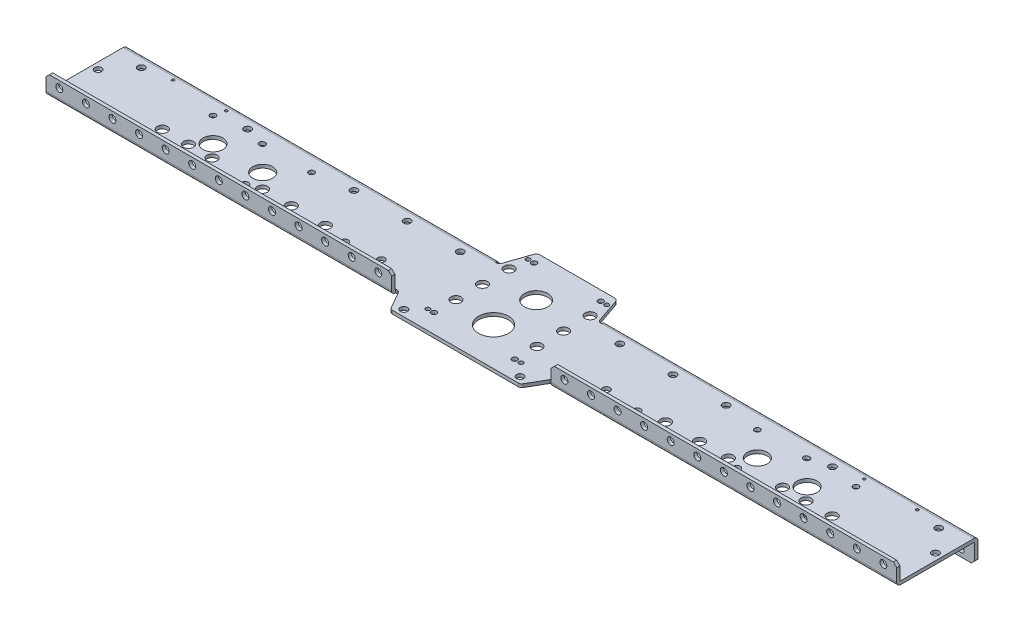
from build123d import *

# Parameters (mm, degrees)
SKETCH1_R           = 3.3528
SKETCH1_R_2         = 9.525
SKETCH1_R_3         = 4.826
SKETCH1_R_4         = 1.27
SKETCH1_R_5         = 2.667
SKETCH1_R_6         = 3.4036
SKETCH1_R_7         = 2.032
SKETCH1_R_8         = 2.54
SKETCH1_R_9         = 4.7625
SKETCH1_R_10        = 11.1125
SKETCH1_R_11        = 14.2875
BOSS_EXTRUDE1_DEPTH = 3.175
BOSS_EXTRUDE2_DEPTH = 355.6
CUT_EXTRUDE1_REACH  = 820.306
SKETCH4_R           = 2.667
BOSS_EXTRUDE3_DEPTH = 330.2
CUT_EXTRUDE2_REACH  = 820.914
SKETCH7_R           = 3.3528
BOSS_EXTRUDE4_START = -355.6
BOSS_EXTRUDE4_DEPTH = 355.6
BOSS_EXTRUDE5_START = -330.2
BOSS_EXTRUDE5_DEPTH = 330.2
CHAMFER1_SIZE       = 3.175
CUT_EXTRUDE3_REACH  = 821.3
SKETCH9_R           = 3.3528
CUT_EXTRUDE4_REACH  = 820.306
SKETCH10_R          = 2.667


with BuildPart() as part:
    # Sketch1 → Boss-Extrude1 (new body)
    with BuildSketch(Plane(origin=(0, 0, 0), x_dir=(1, 0, 0), z_dir=(0, 1, 0))):
        with BuildLine():
            Line((442.314699422, 97.282), (370.485300578, 97.282))
            ThreePointArc((370.485300578, 97.282), (368.641568694, 96.691816771), (367.483279101, 95.14067889))
            Line((367.483279101, 95.14067889), (359.512315987, 71.99132111))
            ThreePointArc((359.512315987, 71.99132111), (358.354026394, 70.440183229), (356.510294509, 69.85))
            Line((356.510294509, 69.85), (355.6, 69.85))
            Line((355.6, 69.85), (0, 69.85))
            Line((0, 69.85), (0, 0))
            Line((0, 0), (330.2, 0))
            Line((330.2, 0), (331.541912895, 0))
            ThreePointArc((331.541912895, 0), (333.129412895, -0.425369343), (334.291543552, -1.5875))
            Line((334.291543552, -1.5875), (343.456979076, -17.4625))
            ThreePointArc((343.456979076, -17.4625), (344.619109733, -18.624630657), (346.206609733, -19.05))
            Line((346.206609733, -19.05), (466.593390267, -19.05))
            ThreePointArc((466.593390267, -19.05), (468.180890267, -18.624630657), (469.343020924, -17.4625))
            Line((469.343020924, -17.4625), (478.508456448, -1.5875))
            ThreePointArc((478.508456448, -1.5875), (479.670587105, -0.425369343), (481.258087105, 0))
            Line((481.258087105, 0), (482.6, 0))
            Line((482.6, 0), (812.8, 0))
            Line((812.8, 0), (812.8, 69.85))
            Line((812.8, 69.85), (457.2, 69.85))
            Line((457.2, 69.85), (456.289705491, 69.85))
            ThreePointArc((456.289705491, 69.85), (454.445973606, 70.440183229), (453.287684013, 71.99132111))
            Line((453.287684013, 71.99132111), (445.316720899, 95.14067889))
            ThreePointArc((445.316720899, 95.14067889), (444.158431306, 96.691816771), (442.314699422, 97.282))
        make_face()
        with Locations(Location((806.45, 39.497, 0), (0, 0, 270))):
            Circle(SKETCH1_R, mode=Mode.SUBTRACT)
        with Locations(Location((641.35, 14.732, 0), (0, 0, 270))):
            Circle(SKETCH1_R, mode=Mode.SUBTRACT)
        with Locations(Location((642.712889143, 33.02, 0), (0, 0, 270))):
            Circle(SKETCH1_R_2, mode=Mode.SUBTRACT)
        with Locations(Location((678.944202666, 20.828, 0), (0, 0, 270))):
            Circle(SKETCH1_R_3, mode=Mode.SUBTRACT)
        with Locations(Location((711.2, 3.175, 0), (0, 0, 270))):
            Circle(SKETCH1_R_4, mode=Mode.SUBTRACT)
        with Locations(Location((713.545953249, 9.671334085, 0), (0, 0, 270))):
            Circle(SKETCH1_R_5, mode=Mode.SUBTRACT)
        with Locations(Location((701.450372003, 20.828, 0), (0, 0, 270))):
            Circle(SKETCH1_R_3, mode=Mode.SUBTRACT)
        with Locations(Location((690.197287335, 33.02, 0), (0, 0, 270))):
            Circle(SKETCH1_R_2, mode=Mode.SUBTRACT)
        with Locations(Location((685.8, 61.722, 0), (0, 0, 270))):
            Circle(SKETCH1_R, mode=Mode.SUBTRACT)
        with Locations(Location((711.2, 66.675, 0), (0, 0, 270))):
            Circle(SKETCH1_R_4, mode=Mode.SUBTRACT)
        with Locations(Location((713.545953249, 56.368665915, 0), (0, 0, 270))):
            Circle(SKETCH1_R_5, mode=Mode.SUBTRACT)
        with Locations(Location((726.460886343, 20.828, 0), (0, 0, 270))):
            Circle(SKETCH1_R_3, mode=Mode.SUBTRACT)
        with Locations(Location((762, 3.175, 0), (0, 0, 270))):
            Circle(SKETCH1_R_4, mode=Mode.SUBTRACT)
        with Locations(Location((762, 66.675, 0), (0, 0, 270))):
            Circle(SKETCH1_R_4, mode=Mode.SUBTRACT)
        with Locations(Location((787.4, 61.722, 0), (0, 0, 270))):
            Circle(SKETCH1_R, mode=Mode.SUBTRACT)
        with Locations(Location((350.8375, -12.8905, 0), (0, 0, 270))):
            Circle(SKETCH1_R_6, mode=Mode.SUBTRACT)
        with Locations(Location((361.9119, -1.03886, 0), (0, 0, 270))):
            Circle(SKETCH1_R_7, mode=Mode.SUBTRACT)
        with Locations(Location((367.7539, -1.03886, 0), (0, 0, 270))):
            Circle(SKETCH1_R_8, mode=Mode.SUBTRACT)
        with Locations(Location((367.67570279, 20.066, 0), (0, 0, 270))):
            Circle(SKETCH1_R_9, mode=Mode.SUBTRACT)
        with Locations(Location((367.67570279, 45.466, 0), (0, 0, 270))):
            Circle(SKETCH1_R_9, mode=Mode.SUBTRACT)
        with Locations(Location((367.67570279, 70.866, 0), (0, 0, 270))):
            Circle(SKETCH1_R_9, mode=Mode.SUBTRACT)
        with Locations(Location((368.808, 87.85352, 0), (0, 0, 270))):
            Circle(SKETCH1_R_7, mode=Mode.SUBTRACT)
        with Locations(Location((374.65, 87.85352, 0), (0, 0, 270))):
            Circle(SKETCH1_R_8, mode=Mode.SUBTRACT)
        with Locations(Location((406.4, 57.9628, 0), (0, 0, 270))):
            Circle(SKETCH1_R_10, mode=Mode.SUBTRACT)
        with Locations(Location((406.4, 17.272, 0), (0, 0, 270))):
            Circle(SKETCH1_R_11, mode=Mode.SUBTRACT)
        with Locations(Location((461.9625, -12.8905, 0), (0, 0, 270))):
            Circle(SKETCH1_R_6, mode=Mode.SUBTRACT)
        with Locations(Location((445.0461, -1.03886, 0), (0, 0, 270))):
            Circle(SKETCH1_R_8, mode=Mode.SUBTRACT)
        with Locations(Location((450.8881, -1.03886, 0), (0, 0, 270))):
            Circle(SKETCH1_R_7, mode=Mode.SUBTRACT)
        with Locations(Location((445.12429721, 20.066, 0), (0, 0, 270))):
            Circle(SKETCH1_R_9, mode=Mode.SUBTRACT)
        with Locations(Location((445.12429721, 45.466, 0), (0, 0, 270))):
            Circle(SKETCH1_R_9, mode=Mode.SUBTRACT)
        with Locations(Location((438.15, 87.85352, 0), (0, 0, 270))):
            Circle(SKETCH1_R_8, mode=Mode.SUBTRACT)
        with Locations(Location((443.992, 87.85352, 0), (0, 0, 270))):
            Circle(SKETCH1_R_7, mode=Mode.SUBTRACT)
        with Locations(Location((445.12429721, 70.866, 0), (0, 0, 270))):
            Circle(SKETCH1_R_9, mode=Mode.SUBTRACT)
        with Locations(Location((482.6, 61.722, 0), (0, 0, 270))):
            Circle(SKETCH1_R, mode=Mode.SUBTRACT)
        with Locations(Location((513.925467617, 17.547282407, 0), (0, 0, 270))):
            Circle(SKETCH1_R, mode=Mode.SUBTRACT)
        with Locations(Location((533.4, 61.722, 0), (0, 0, 270))):
            Circle(SKETCH1_R, mode=Mode.SUBTRACT)
        with Locations(Location((546.1, 14.732, 0), (0, 0, 270))):
            Circle(SKETCH1_R, mode=Mode.SUBTRACT)
        with Locations(Location((568.924874752, 19.05, 0), (0, 0, 270))):
            Circle(SKETCH1_R_3, mode=Mode.SUBTRACT)
        with Locations(Location((584.2, 61.722, 0), (0, 0, 270))):
            Circle(SKETCH1_R, mode=Mode.SUBTRACT)
        with Locations(Location((619.364223229, 56.368665915, 0), (0, 0, 270))):
            Circle(SKETCH1_R_5, mode=Mode.SUBTRACT)
        with Locations(Location((601.438495912, 19.05, 0), (0, 0, 270))):
            Circle(SKETCH1_R_3, mode=Mode.SUBTRACT)
        with Locations(Location((619.364223229, 9.671334085, 0), (0, 0, 270))):
            Circle(SKETCH1_R_5, mode=Mode.SUBTRACT)
        with Locations(Location((628.947697627, 19.05, 0), (0, 0, 270))):
            Circle(SKETCH1_R_3, mode=Mode.SUBTRACT)
        with Locations(Location((298.874532383, 17.547282407, 0), (0, 0, 270))):
            Circle(SKETCH1_R, mode=Mode.SUBTRACT)
        with Locations(Location((266.7, 14.732, 0), (0, 0, 270))):
            Circle(SKETCH1_R, mode=Mode.SUBTRACT)
        with Locations(Location((243.875125248, 19.05, 0), (0, 0, 270))):
            Circle(SKETCH1_R_3, mode=Mode.SUBTRACT)
        with Locations(Location((211.361504088, 19.05, 0), (0, 0, 270))):
            Circle(SKETCH1_R_3, mode=Mode.SUBTRACT)
        with Locations(Location((193.435776771, 9.671334085, 0), (0, 0, 270))):
            Circle(SKETCH1_R_5, mode=Mode.SUBTRACT)
        with Locations(Location((183.852302373, 19.05, 0), (0, 0, 270))):
            Circle(SKETCH1_R_3, mode=Mode.SUBTRACT)
        with Locations(Location((170.087110857, 33.02, 0), (0, 0, 270))):
            Circle(SKETCH1_R_2, mode=Mode.SUBTRACT)
        with Locations(Location((171.45, 14.732, 0), (0, 0, 270))):
            Circle(SKETCH1_R, mode=Mode.SUBTRACT)
        with Locations(Location((133.855797334, 20.828, 0), (0, 0, 270))):
            Circle(SKETCH1_R_3, mode=Mode.SUBTRACT)
        with Locations(Location((122.602712665, 33.02, 0), (0, 0, 270))):
            Circle(SKETCH1_R_2, mode=Mode.SUBTRACT)
        with Locations(Location((99.254046751, 56.368665915, 0), (0, 0, 270))):
            Circle(SKETCH1_R_5, mode=Mode.SUBTRACT)
        with Locations(Location((101.6, 66.675, 0), (0, 0, 270))):
            Circle(SKETCH1_R_4, mode=Mode.SUBTRACT)
        with Locations(Location((127, 61.722, 0), (0, 0, 270))):
            Circle(SKETCH1_R, mode=Mode.SUBTRACT)
        with Locations(Location((193.435776771, 56.368665915, 0), (0, 0, 270))):
            Circle(SKETCH1_R_5, mode=Mode.SUBTRACT)
        with Locations(Location((228.6, 61.722, 0), (0, 0, 270))):
            Circle(SKETCH1_R, mode=Mode.SUBTRACT)
        with Locations(Location((279.4, 61.722, 0), (0, 0, 270))):
            Circle(SKETCH1_R, mode=Mode.SUBTRACT)
        with Locations(Location((330.2, 61.722, 0), (0, 0, 270))):
            Circle(SKETCH1_R, mode=Mode.SUBTRACT)
        with Locations(Location((50.8, 66.675, 0), (0, 0, 270))):
            Circle(SKETCH1_R_4, mode=Mode.SUBTRACT)
        with Locations(Location((6.35, 39.497, 0), (0, 0, 270))):
            Circle(SKETCH1_R, mode=Mode.SUBTRACT)
        with Locations(Location((25.4, 61.722, 0), (0, 0, 270))):
            Circle(SKETCH1_R, mode=Mode.SUBTRACT)
        with Locations(Location((50.8, 3.175, 0), (0, 0, 270))):
            Circle(SKETCH1_R_4, mode=Mode.SUBTRACT)
        with Locations(Location((101.6, 3.175, 0), (0, 0, 270))):
            Circle(SKETCH1_R_4, mode=Mode.SUBTRACT)
        with Locations(Location((99.254046751, 9.671334085, 0), (0, 0, 270))):
            Circle(SKETCH1_R_5, mode=Mode.SUBTRACT)
        with Locations(Location((86.339113657, 20.828, 0), (0, 0, 270))):
            Circle(SKETCH1_R_3, mode=Mode.SUBTRACT)
        with Locations(Location((111.349627997, 20.828, 0), (0, 0, 270))):
            Circle(SKETCH1_R_3, mode=Mode.SUBTRACT)
        with BuildLine():
            ThreePointArc((666.455088239, 53.730859888), (669.51562142, 56.368665915), (666.455088239, 59.006471942))
            ThreePointArc((666.455088239, 59.006471942), (663.394555058, 56.368665915), (666.455088239, 53.730859888))
        make_face(mode=Mode.SUBTRACT)
        with BuildLine():
            ThreePointArc((666.455088239, 7.033528058), (669.51562142, 9.671334085), (666.455088239, 12.309140112))
            ThreePointArc((666.455088239, 12.309140112), (663.394555058, 9.671334085), (666.455088239, 7.033528058))
        make_face(mode=Mode.SUBTRACT)
        with BuildLine():
            ThreePointArc((146.344911761, 7.033528058), (149.405444942, 9.671334085), (146.344911761, 12.309140112))
            ThreePointArc((146.344911761, 12.309140112), (143.28437858, 9.671334085), (146.344911761, 7.033528058))
        make_face(mode=Mode.SUBTRACT)
        with BuildLine():
            ThreePointArc((146.344911761, 53.730859888), (149.405444942, 56.368665915), (146.344911761, 59.006471942))
            ThreePointArc((146.344911761, 59.006471942), (143.28437858, 56.368665915), (146.344911761, 53.730859888))
        make_face(mode=Mode.SUBTRACT)
    extrude(amount=BOSS_EXTRUDE1_DEPTH)

    # Sketch3 → Boss-Extrude2 (add)
    with BuildSketch(Plane.ZY):
        with BuildLine():
            Line((-70.612, -15.875), (-70.612, -19.05))
            Line((-70.612, -19.05), (-73.787, -19.05))
            Line((-73.787, -19.05), (-73.787, -15.875))
            Line((-73.787, -15.875), (-73.787, -0.762))
            ThreePointArc((-73.787, -0.762), (-72.633879398, 2.021879398), (-69.85, 3.175))
            Line((-69.85, 3.175), (-69.85, 0))
            ThreePointArc((-69.85, 0), (-70.388815367, -0.223184633), (-70.612, -0.762))
            Line((-70.612, -0.762), (-70.612, -15.875))
        make_face()
    extrude(amount=-BOSS_EXTRUDE2_DEPTH)

    # Sketch4 → Cut-Extrude1 (cut, up to next)
    with BuildSketch(Plane(origin=(0, 0, -73.787), x_dir=(-1, 0, 0), z_dir=(0, 0, -1)), mode=Mode.PRIVATE) as cut_extrude1_sk1:
        with Locations(Location((-342.9, -12.7, 0), (0, 0, 90))):
            Circle(SKETCH4_R)
    cut_extrude1_tool1 = extrude(cut_extrude1_sk1.sketch, amount=-CUT_EXTRUDE1_REACH, mode=Mode.PRIVATE) & part.part
    # Sketch4 → Cut-Extrude1 (cut, up to next)
    with BuildSketch(Plane(origin=(0, 0, -73.787), x_dir=(-1, 0, 0), z_dir=(0, 0, -1)), mode=Mode.PRIVATE) as cut_extrude1_sk2:
        with Locations(Location((-317.5, -12.7, 0), (0, 0, 90))):
            Circle(SKETCH4_R)
    cut_extrude1_tool2 = extrude(cut_extrude1_sk2.sketch, amount=-CUT_EXTRUDE1_REACH, mode=Mode.PRIVATE) & part.part
    # Sketch4 → Cut-Extrude1 (cut, up to next)
    with BuildSketch(Plane(origin=(0, 0, -73.787), x_dir=(-1, 0, 0), z_dir=(0, 0, -1)), mode=Mode.PRIVATE) as cut_extrude1_sk3:
        with Locations(Location((-292.1, -12.7, 0), (0, 0, 90))):
            Circle(SKETCH4_R)
    cut_extrude1_tool3 = extrude(cut_extrude1_sk3.sketch, amount=-CUT_EXTRUDE1_REACH, mode=Mode.PRIVATE) & part.part
    # Sketch4 → Cut-Extrude1 (cut, up to next)
    with BuildSketch(Plane(origin=(0, 0, -73.787), x_dir=(-1, 0, 0), z_dir=(0, 0, -1)), mode=Mode.PRIVATE) as cut_extrude1_sk4:
        with Locations(Location((-266.7, -12.7, 0), (0, 0, 90))):
            Circle(SKETCH4_R)
    cut_extrude1_tool4 = extrude(cut_extrude1_sk4.sketch, amount=-CUT_EXTRUDE1_REACH, mode=Mode.PRIVATE) & part.part
    # Sketch4 → Cut-Extrude1 (cut, up to next)
    with BuildSketch(Plane(origin=(0, 0, -73.787), x_dir=(-1, 0, 0), z_dir=(0, 0, -1)), mode=Mode.PRIVATE) as cut_extrude1_sk5:
        with Locations(Location((-241.3, -12.7, 0), (0, 0, 90))):
            Circle(SKETCH4_R)
    cut_extrude1_tool5 = extrude(cut_extrude1_sk5.sketch, amount=-CUT_EXTRUDE1_REACH, mode=Mode.PRIVATE) & part.part
    # Sketch4 → Cut-Extrude1 (cut, up to next)
    with BuildSketch(Plane(origin=(0, 0, -73.787), x_dir=(-1, 0, 0), z_dir=(0, 0, -1)), mode=Mode.PRIVATE) as cut_extrude1_sk6:
        with Locations(Location((-215.9, -12.7, 0), (0, 0, 90))):
            Circle(SKETCH4_R)
    cut_extrude1_tool6 = extrude(cut_extrude1_sk6.sketch, amount=-CUT_EXTRUDE1_REACH, mode=Mode.PRIVATE) & part.part
    # Sketch4 → Cut-Extrude1 (cut, up to next)
    with BuildSketch(Plane(origin=(0, 0, -73.787), x_dir=(-1, 0, 0), z_dir=(0, 0, -1)), mode=Mode.PRIVATE) as cut_extrude1_sk7:
        with Locations(Location((-190.5, -12.7, 0), (0, 0, 90))):
            Circle(SKETCH4_R)
    cut_extrude1_tool7 = extrude(cut_extrude1_sk7.sketch, amount=-CUT_EXTRUDE1_REACH, mode=Mode.PRIVATE) & part.part
    # Sketch4 → Cut-Extrude1 (cut, up to next)
    with BuildSketch(Plane(origin=(0, 0, -73.787), x_dir=(-1, 0, 0), z_dir=(0, 0, -1)), mode=Mode.PRIVATE) as cut_extrude1_sk8:
        with Locations(Location((-165.1, -12.7, 0), (0, 0, 90))):
            Circle(SKETCH4_R)
    cut_extrude1_tool8 = extrude(cut_extrude1_sk8.sketch, amount=-CUT_EXTRUDE1_REACH, mode=Mode.PRIVATE) & part.part
    # Sketch4 → Cut-Extrude1 (cut, up to next)
    with BuildSketch(Plane(origin=(0, 0, -73.787), x_dir=(-1, 0, 0), z_dir=(0, 0, -1)), mode=Mode.PRIVATE) as cut_extrude1_sk9:
        with Locations(Location((-139.7, -12.7, 0), (0, 0, 90))):
            Circle(SKETCH4_R)
    cut_extrude1_tool9 = extrude(cut_extrude1_sk9.sketch, amount=-CUT_EXTRUDE1_REACH, mode=Mode.PRIVATE) & part.part
    # Sketch4 → Cut-Extrude1 (cut, up to next)
    with BuildSketch(Plane(origin=(0, 0, -73.787), x_dir=(-1, 0, 0), z_dir=(0, 0, -1)), mode=Mode.PRIVATE) as cut_extrude1_sk10:
        with Locations(Location((-114.3, -12.7, 0), (0, 0, 90))):
            Circle(SKETCH4_R)
    cut_extrude1_tool10 = extrude(cut_extrude1_sk10.sketch, amount=-CUT_EXTRUDE1_REACH, mode=Mode.PRIVATE) & part.part
    # Sketch4 → Cut-Extrude1 (cut, up to next)
    with BuildSketch(Plane(origin=(0, 0, -73.787), x_dir=(-1, 0, 0), z_dir=(0, 0, -1)), mode=Mode.PRIVATE) as cut_extrude1_sk11:
        with Locations(Location((-88.9, -12.7, 0), (0, 0, 90))):
            Circle(SKETCH4_R)
    cut_extrude1_tool11 = extrude(cut_extrude1_sk11.sketch, amount=-CUT_EXTRUDE1_REACH, mode=Mode.PRIVATE) & part.part
    # Sketch4 → Cut-Extrude1 (cut, up to next)
    with BuildSketch(Plane(origin=(0, 0, -73.787), x_dir=(-1, 0, 0), z_dir=(0, 0, -1)), mode=Mode.PRIVATE) as cut_extrude1_sk12:
        with Locations(Location((-63.5, -12.7, 0), (0, 0, 90))):
            Circle(SKETCH4_R)
    cut_extrude1_tool12 = extrude(cut_extrude1_sk12.sketch, amount=-CUT_EXTRUDE1_REACH, mode=Mode.PRIVATE) & part.part
    # Sketch4 → Cut-Extrude1 (cut, up to next)
    with BuildSketch(Plane(origin=(0, 0, -73.787), x_dir=(-1, 0, 0), z_dir=(0, 0, -1)), mode=Mode.PRIVATE) as cut_extrude1_sk13:
        with Locations(Location((-38.1, -12.7, 0), (0, 0, 90))):
            Circle(SKETCH4_R)
    cut_extrude1_tool13 = extrude(cut_extrude1_sk13.sketch, amount=-CUT_EXTRUDE1_REACH, mode=Mode.PRIVATE) & part.part
    # Sketch4 → Cut-Extrude1 (cut, up to next)
    with BuildSketch(Plane(origin=(0, 0, -73.787), x_dir=(-1, 0, 0), z_dir=(0, 0, -1)), mode=Mode.PRIVATE) as cut_extrude1_sk14:
        with Locations(Location((-12.7, -12.7, 0), (0, 0, 90))):
            Circle(SKETCH4_R)
    cut_extrude1_tool14 = extrude(cut_extrude1_sk14.sketch, amount=-CUT_EXTRUDE1_REACH, mode=Mode.PRIVATE) & part.part
    add(cut_extrude1_tool1.solids().sort_by_distance((342.9, -12.7, -73.787))[0], mode=Mode.SUBTRACT)
    add(cut_extrude1_tool2.solids().sort_by_distance((317.5, -12.7, -73.787))[0], mode=Mode.SUBTRACT)
    add(cut_extrude1_tool3.solids().sort_by_distance((292.1, -12.7, -73.787))[0], mode=Mode.SUBTRACT)
    add(cut_extrude1_tool4.solids().sort_by_distance((266.7, -12.7, -73.787))[0], mode=Mode.SUBTRACT)
    add(cut_extrude1_tool5.solids().sort_by_distance((241.3, -12.7, -73.787))[0], mode=Mode.SUBTRACT)
    add(cut_extrude1_tool6.solids().sort_by_distance((215.9, -12.7, -73.787))[0], mode=Mode.SUBTRACT)
    add(cut_extrude1_tool7.solids().sort_by_distance((190.5, -12.7, -73.787))[0], mode=Mode.SUBTRACT)
    add(cut_extrude1_tool8.solids().sort_by_distance((165.1, -12.7, -73.787))[0], mode=Mode.SUBTRACT)
    add(cut_extrude1_tool9.solids().sort_by_distance((139.7, -12.7, -73.787))[0], mode=Mode.SUBTRACT)
    add(cut_extrude1_tool10.solids().sort_by_distance((114.3, -12.7, -73.787))[0], mode=Mode.SUBTRACT)
    add(cut_extrude1_tool11.solids().sort_by_distance((88.9, -12.7, -73.787))[0], mode=Mode.SUBTRACT)
    add(cut_extrude1_tool12.solids().sort_by_distance((63.5, -12.7, -73.787))[0], mode=Mode.SUBTRACT)
    add(cut_extrude1_tool13.solids().sort_by_distance((38.1, -12.7, -73.787))[0], mode=Mode.SUBTRACT)
    add(cut_extrude1_tool14.solids().sort_by_distance((12.7, -12.7, -73.787))[0], mode=Mode.SUBTRACT)

    # Sketch5 → Boss-Extrude3 (add)
    with BuildSketch(Plane.ZY):
        with BuildLine():
            Line((3.937, 3.937), (3.937, 15.875))
            Line((3.937, 15.875), (3.937, 19.05))
            Line((3.937, 19.05), (0.762, 19.05))
            Line((0.762, 19.05), (0.762, 15.875))
            Line((0.762, 15.875), (0.762, 3.937))
            ThreePointArc((0.762, 3.937), (0.538815367, 3.398184633), (0, 3.175))
            Line((0, 3.175), (0, 0))
            ThreePointArc((0, 0), (2.783879398, 1.153120602), (3.937, 3.937))
        make_face()
    extrude(amount=-BOSS_EXTRUDE3_DEPTH)

    # Sketch7 → Cut-Extrude2 (cut, up to next)
    with BuildSketch(Plane(origin=(0, 0, 0.762), x_dir=(-1, 0, 0), z_dir=(0, 0, -1)), mode=Mode.PRIVATE) as cut_extrude2_sk1:
        with Locations(Location((-12.7, 12.7, 0), (0, 0, 90))):
            Circle(SKETCH7_R)
    cut_extrude2_tool1 = extrude(cut_extrude2_sk1.sketch, amount=-CUT_EXTRUDE2_REACH, mode=Mode.PRIVATE) & part.part
    # Sketch7 → Cut-Extrude2 (cut, up to next)
    with BuildSketch(Plane(origin=(0, 0, 0.762), x_dir=(-1, 0, 0), z_dir=(0, 0, -1)), mode=Mode.PRIVATE) as cut_extrude2_sk2:
        with Locations(Location((-38.1, 12.7, 0), (0, 0, 90))):
            Circle(SKETCH7_R)
    cut_extrude2_tool2 = extrude(cut_extrude2_sk2.sketch, amount=-CUT_EXTRUDE2_REACH, mode=Mode.PRIVATE) & part.part
    # Sketch7 → Cut-Extrude2 (cut, up to next)
    with BuildSketch(Plane(origin=(0, 0, 0.762), x_dir=(-1, 0, 0), z_dir=(0, 0, -1)), mode=Mode.PRIVATE) as cut_extrude2_sk3:
        with Locations(Location((-63.5, 12.7, 0), (0, 0, 90))):
            Circle(SKETCH7_R)
    cut_extrude2_tool3 = extrude(cut_extrude2_sk3.sketch, amount=-CUT_EXTRUDE2_REACH, mode=Mode.PRIVATE) & part.part
    # Sketch7 → Cut-Extrude2 (cut, up to next)
    with BuildSketch(Plane(origin=(0, 0, 0.762), x_dir=(-1, 0, 0), z_dir=(0, 0, -1)), mode=Mode.PRIVATE) as cut_extrude2_sk4:
        with Locations(Location((-88.9, 12.7, 0), (0, 0, 90))):
            Circle(SKETCH7_R)
    cut_extrude2_tool4 = extrude(cut_extrude2_sk4.sketch, amount=-CUT_EXTRUDE2_REACH, mode=Mode.PRIVATE) & part.part
    # Sketch7 → Cut-Extrude2 (cut, up to next)
    with BuildSketch(Plane(origin=(0, 0, 0.762), x_dir=(-1, 0, 0), z_dir=(0, 0, -1)), mode=Mode.PRIVATE) as cut_extrude2_sk5:
        with Locations(Location((-114.3, 12.7, 0), (0, 0, 90))):
            Circle(SKETCH7_R)
    cut_extrude2_tool5 = extrude(cut_extrude2_sk5.sketch, amount=-CUT_EXTRUDE2_REACH, mode=Mode.PRIVATE) & part.part
    # Sketch7 → Cut-Extrude2 (cut, up to next)
    with BuildSketch(Plane(origin=(0, 0, 0.762), x_dir=(-1, 0, 0), z_dir=(0, 0, -1)), mode=Mode.PRIVATE) as cut_extrude2_sk6:
        with Locations(Location((-241.3, 12.7, 0), (0, 0, 90))):
            Circle(SKETCH7_R)
    cut_extrude2_tool6 = extrude(cut_extrude2_sk6.sketch, amount=-CUT_EXTRUDE2_REACH, mode=Mode.PRIVATE) & part.part
    # Sketch7 → Cut-Extrude2 (cut, up to next)
    with BuildSketch(Plane(origin=(0, 0, 0.762), x_dir=(-1, 0, 0), z_dir=(0, 0, -1)), mode=Mode.PRIVATE) as cut_extrude2_sk7:
        with Locations(Location((-215.9, 12.7, 0), (0, 0, 90))):
            Circle(SKETCH7_R)
    cut_extrude2_tool7 = extrude(cut_extrude2_sk7.sketch, amount=-CUT_EXTRUDE2_REACH, mode=Mode.PRIVATE) & part.part
    # Sketch7 → Cut-Extrude2 (cut, up to next)
    with BuildSketch(Plane(origin=(0, 0, 0.762), x_dir=(-1, 0, 0), z_dir=(0, 0, -1)), mode=Mode.PRIVATE) as cut_extrude2_sk8:
        with Locations(Location((-190.5, 12.7, 0), (0, 0, 90))):
            Circle(SKETCH7_R)
    cut_extrude2_tool8 = extrude(cut_extrude2_sk8.sketch, amount=-CUT_EXTRUDE2_REACH, mode=Mode.PRIVATE) & part.part
    # Sketch7 → Cut-Extrude2 (cut, up to next)
    with BuildSketch(Plane(origin=(0, 0, 0.762), x_dir=(-1, 0, 0), z_dir=(0, 0, -1)), mode=Mode.PRIVATE) as cut_extrude2_sk9:
        with Locations(Location((-165.1, 12.7, 0), (0, 0, 90))):
            Circle(SKETCH7_R)
    cut_extrude2_tool9 = extrude(cut_extrude2_sk9.sketch, amount=-CUT_EXTRUDE2_REACH, mode=Mode.PRIVATE) & part.part
    # Sketch7 → Cut-Extrude2 (cut, up to next)
    with BuildSketch(Plane(origin=(0, 0, 0.762), x_dir=(-1, 0, 0), z_dir=(0, 0, -1)), mode=Mode.PRIVATE) as cut_extrude2_sk10:
        with Locations(Location((-139.7, 12.7, 0), (0, 0, 90))):
            Circle(SKETCH7_R)
    cut_extrude2_tool10 = extrude(cut_extrude2_sk10.sketch, amount=-CUT_EXTRUDE2_REACH, mode=Mode.PRIVATE) & part.part
    # Sketch7 → Cut-Extrude2 (cut, up to next)
    with BuildSketch(Plane(origin=(0, 0, 0.762), x_dir=(-1, 0, 0), z_dir=(0, 0, -1)), mode=Mode.PRIVATE) as cut_extrude2_sk11:
        with Locations(Location((-317.5, 12.7, 0), (0, 0, 90))):
            Circle(SKETCH7_R)
    cut_extrude2_tool11 = extrude(cut_extrude2_sk11.sketch, amount=-CUT_EXTRUDE2_REACH, mode=Mode.PRIVATE) & part.part
    # Sketch7 → Cut-Extrude2 (cut, up to next)
    with BuildSketch(Plane(origin=(0, 0, 0.762), x_dir=(-1, 0, 0), z_dir=(0, 0, -1)), mode=Mode.PRIVATE) as cut_extrude2_sk12:
        with Locations(Location((-292.1, 12.7, 0), (0, 0, 90))):
            Circle(SKETCH7_R)
    cut_extrude2_tool12 = extrude(cut_extrude2_sk12.sketch, amount=-CUT_EXTRUDE2_REACH, mode=Mode.PRIVATE) & part.part
    # Sketch7 → Cut-Extrude2 (cut, up to next)
    with BuildSketch(Plane(origin=(0, 0, 0.762), x_dir=(-1, 0, 0), z_dir=(0, 0, -1)), mode=Mode.PRIVATE) as cut_extrude2_sk13:
        with Locations(Location((-266.7, 12.7, 0), (0, 0, 90))):
            Circle(SKETCH7_R)
    cut_extrude2_tool13 = extrude(cut_extrude2_sk13.sketch, amount=-CUT_EXTRUDE2_REACH, mode=Mode.PRIVATE) & part.part
    add(cut_extrude2_tool1.solids().sort_by_distance((12.7, 12.7, 0.762))[0], mode=Mode.SUBTRACT)
    add(cut_extrude2_tool2.solids().sort_by_distance((38.1, 12.7, 0.762))[0], mode=Mode.SUBTRACT)
    add(cut_extrude2_tool3.solids().sort_by_distance((63.5, 12.7, 0.762))[0], mode=Mode.SUBTRACT)
    add(cut_extrude2_tool4.solids().sort_by_distance((88.9, 12.7, 0.762))[0], mode=Mode.SUBTRACT)
    add(cut_extrude2_tool5.solids().sort_by_distance((114.3, 12.7, 0.762))[0], mode=Mode.SUBTRACT)
    add(cut_extrude2_tool6.solids().sort_by_distance((241.3, 12.7, 0.762))[0], mode=Mode.SUBTRACT)
    add(cut_extrude2_tool7.solids().sort_by_distance((215.9, 12.7, 0.762))[0], mode=Mode.SUBTRACT)
    add(cut_extrude2_tool8.solids().sort_by_distance((190.5, 12.7, 0.762))[0], mode=Mode.SUBTRACT)
    add(cut_extrude2_tool9.solids().sort_by_distance((165.1, 12.7, 0.762))[0], mode=Mode.SUBTRACT)
    add(cut_extrude2_tool10.solids().sort_by_distance((139.7, 12.7, 0.762))[0], mode=Mode.SUBTRACT)
    add(cut_extrude2_tool11.solids().sort_by_distance((317.5, 12.7, 0.762))[0], mode=Mode.SUBTRACT)
    add(cut_extrude2_tool12.solids().sort_by_distance((292.1, 12.7, 0.762))[0], mode=Mode.SUBTRACT)
    add(cut_extrude2_tool13.solids().sort_by_distance((266.7, 12.7, 0.762))[0], mode=Mode.SUBTRACT)

    # Sketch6 → Boss-Extrude4 (add)
    with BuildSketch(Plane(origin=(812.8, 0, 0), x_dir=(0, 0, -1), z_dir=(1, 0, 0)).offset(BOSS_EXTRUDE4_START)):
        with BuildLine():
            Line((73.787, -19.05), (73.787, -15.875))
            Line((73.787, -15.875), (73.787, -0.762))
            ThreePointArc((73.787, -0.762), (72.633879398, 2.021879398), (69.85, 3.175))
            Line((69.85, 3.175), (69.85, 0))
            ThreePointArc((69.85, 0), (70.388815367, -0.223184633), (70.612, -0.762))
            Line((70.612, -0.762), (70.612, -15.875))
            Line((70.612, -15.875), (70.612, -19.05))
            Line((70.612, -19.05), (73.787, -19.05))
        make_face()
    extrude(amount=BOSS_EXTRUDE4_DEPTH)

    # Sketch8 → Boss-Extrude5 (add)
    with BuildSketch(Plane(origin=(812.8, 0, 0), x_dir=(0, 0, -1), z_dir=(1, 0, 0)).offset(BOSS_EXTRUDE5_START)):
        with BuildLine():
            Line((-0.762, 3.937), (-0.762, 15.875))
            Line((-0.762, 15.875), (-0.762, 19.05))
            Line((-0.762, 19.05), (-3.937, 19.05))
            Line((-3.937, 19.05), (-3.937, 15.875))
            Line((-3.937, 15.875), (-3.937, 3.937))
            ThreePointArc((-3.937, 3.937), (-2.783879397, 1.153120602), (0, 0))
            Line((0, 0), (0, 3.175))
            ThreePointArc((0, 3.175), (-0.538815367, 3.398184633), (-0.762, 3.937))
        make_face()
    extrude(amount=BOSS_EXTRUDE5_DEPTH)

    # Chamfer1
    chamfer1_edges = [part.edges().sort_by_distance(p)[0] for p in [
        (355.6, -19.05, -72.1995),
        (0, -19.05, -72.1995),
        (330.2, 19.05, 2.3495),
        (0, 19.05, 2.3495),
        (457.2, -19.05, -72.1995),
        (812.8, -19.05, -72.1995),
        (482.6, 19.05, 2.3495),
        (812.8, 19.05, 2.3495),
    ]]
    chamfer(chamfer1_edges, length=CHAMFER1_SIZE)

    # Sketch9 → Cut-Extrude3 (cut, up to next)
    with BuildSketch(Plane.XY.offset(3.937), mode=Mode.PRIVATE) as cut_extrude3_sk1:
        with Locations((698.5, 12.7)):
            Circle(SKETCH9_R)
    cut_extrude3_tool1 = extrude(cut_extrude3_sk1.sketch, amount=-CUT_EXTRUDE3_REACH, mode=Mode.PRIVATE) & part.part
    # Sketch9 → Cut-Extrude3 (cut, up to next)
    with BuildSketch(Plane.XY.offset(3.937), mode=Mode.PRIVATE) as cut_extrude3_sk2:
        with Locations((723.9, 12.7)):
            Circle(SKETCH9_R)
    cut_extrude3_tool2 = extrude(cut_extrude3_sk2.sketch, amount=-CUT_EXTRUDE3_REACH, mode=Mode.PRIVATE) & part.part
    # Sketch9 → Cut-Extrude3 (cut, up to next)
    with BuildSketch(Plane.XY.offset(3.937), mode=Mode.PRIVATE) as cut_extrude3_sk3:
        with Locations((749.3, 12.7)):
            Circle(SKETCH9_R)
    cut_extrude3_tool3 = extrude(cut_extrude3_sk3.sketch, amount=-CUT_EXTRUDE3_REACH, mode=Mode.PRIVATE) & part.part
    # Sketch9 → Cut-Extrude3 (cut, up to next)
    with BuildSketch(Plane.XY.offset(3.937), mode=Mode.PRIVATE) as cut_extrude3_sk4:
        with Locations((774.7, 12.7)):
            Circle(SKETCH9_R)
    cut_extrude3_tool4 = extrude(cut_extrude3_sk4.sketch, amount=-CUT_EXTRUDE3_REACH, mode=Mode.PRIVATE) & part.part
    # Sketch9 → Cut-Extrude3 (cut, up to next)
    with BuildSketch(Plane.XY.offset(3.937), mode=Mode.PRIVATE) as cut_extrude3_sk5:
        with Locations((800.1, 12.7)):
            Circle(SKETCH9_R)
    cut_extrude3_tool5 = extrude(cut_extrude3_sk5.sketch, amount=-CUT_EXTRUDE3_REACH, mode=Mode.PRIVATE) & part.part
    # Sketch9 → Cut-Extrude3 (cut, up to next)
    with BuildSketch(Plane.XY.offset(3.937), mode=Mode.PRIVATE) as cut_extrude3_sk6:
        with Locations((647.7, 12.7)):
            Circle(SKETCH9_R)
    cut_extrude3_tool6 = extrude(cut_extrude3_sk6.sketch, amount=-CUT_EXTRUDE3_REACH, mode=Mode.PRIVATE) & part.part
    # Sketch9 → Cut-Extrude3 (cut, up to next)
    with BuildSketch(Plane.XY.offset(3.937), mode=Mode.PRIVATE) as cut_extrude3_sk7:
        with Locations((673.1, 12.7)):
            Circle(SKETCH9_R)
    cut_extrude3_tool7 = extrude(cut_extrude3_sk7.sketch, amount=-CUT_EXTRUDE3_REACH, mode=Mode.PRIVATE) & part.part
    # Sketch9 → Cut-Extrude3 (cut, up to next)
    with BuildSketch(Plane.XY.offset(3.937), mode=Mode.PRIVATE) as cut_extrude3_sk8:
        with Locations((571.5, 12.7)):
            Circle(SKETCH9_R)
    cut_extrude3_tool8 = extrude(cut_extrude3_sk8.sketch, amount=-CUT_EXTRUDE3_REACH, mode=Mode.PRIVATE) & part.part
    # Sketch9 → Cut-Extrude3 (cut, up to next)
    with BuildSketch(Plane.XY.offset(3.937), mode=Mode.PRIVATE) as cut_extrude3_sk9:
        with Locations((596.9, 12.7)):
            Circle(SKETCH9_R)
    cut_extrude3_tool9 = extrude(cut_extrude3_sk9.sketch, amount=-CUT_EXTRUDE3_REACH, mode=Mode.PRIVATE) & part.part
    # Sketch9 → Cut-Extrude3 (cut, up to next)
    with BuildSketch(Plane.XY.offset(3.937), mode=Mode.PRIVATE) as cut_extrude3_sk10:
        with Locations((622.3, 12.7)):
            Circle(SKETCH9_R)
    cut_extrude3_tool10 = extrude(cut_extrude3_sk10.sketch, amount=-CUT_EXTRUDE3_REACH, mode=Mode.PRIVATE) & part.part
    # Sketch9 → Cut-Extrude3 (cut, up to next)
    with BuildSketch(Plane.XY.offset(3.937), mode=Mode.PRIVATE) as cut_extrude3_sk11:
        with Locations((546.1, 12.7)):
            Circle(SKETCH9_R)
    cut_extrude3_tool11 = extrude(cut_extrude3_sk11.sketch, amount=-CUT_EXTRUDE3_REACH, mode=Mode.PRIVATE) & part.part
    # Sketch9 → Cut-Extrude3 (cut, up to next)
    with BuildSketch(Plane.XY.offset(3.937), mode=Mode.PRIVATE) as cut_extrude3_sk12:
        with Locations((520.7, 12.7)):
            Circle(SKETCH9_R)
    cut_extrude3_tool12 = extrude(cut_extrude3_sk12.sketch, amount=-CUT_EXTRUDE3_REACH, mode=Mode.PRIVATE) & part.part
    # Sketch9 → Cut-Extrude3 (cut, up to next)
    with BuildSketch(Plane.XY.offset(3.937), mode=Mode.PRIVATE) as cut_extrude3_sk13:
        with Locations((495.3, 12.7)):
            Circle(SKETCH9_R)
    cut_extrude3_tool13 = extrude(cut_extrude3_sk13.sketch, amount=-CUT_EXTRUDE3_REACH, mode=Mode.PRIVATE) & part.part
    add(cut_extrude3_tool1.solids().sort_by_distance((698.5, 12.7, 3.937))[0], mode=Mode.SUBTRACT)
    add(cut_extrude3_tool2.solids().sort_by_distance((723.9, 12.7, 3.937))[0], mode=Mode.SUBTRACT)
    add(cut_extrude3_tool3.solids().sort_by_distance((749.3, 12.7, 3.937))[0], mode=Mode.SUBTRACT)
    add(cut_extrude3_tool4.solids().sort_by_distance((774.7, 12.7, 3.937))[0], mode=Mode.SUBTRACT)
    add(cut_extrude3_tool5.solids().sort_by_distance((800.1, 12.7, 3.937))[0], mode=Mode.SUBTRACT)
    add(cut_extrude3_tool6.solids().sort_by_distance((647.7, 12.7, 3.937))[0], mode=Mode.SUBTRACT)
    add(cut_extrude3_tool7.solids().sort_by_distance((673.1, 12.7, 3.937))[0], mode=Mode.SUBTRACT)
    add(cut_extrude3_tool8.solids().sort_by_distance((571.5, 12.7, 3.937))[0], mode=Mode.SUBTRACT)
    add(cut_extrude3_tool9.solids().sort_by_distance((596.9, 12.7, 3.937))[0], mode=Mode.SUBTRACT)
    add(cut_extrude3_tool10.solids().sort_by_distance((622.3, 12.7, 3.937))[0], mode=Mode.SUBTRACT)
    add(cut_extrude3_tool11.solids().sort_by_distance((546.1, 12.7, 3.937))[0], mode=Mode.SUBTRACT)
    add(cut_extrude3_tool12.solids().sort_by_distance((520.7, 12.7, 3.937))[0], mode=Mode.SUBTRACT)
    add(cut_extrude3_tool13.solids().sort_by_distance((495.3, 12.7, 3.937))[0], mode=Mode.SUBTRACT)

    # Sketch10 → Cut-Extrude4 (cut, up to next)
    with BuildSketch(Plane(origin=(0, 0, -73.787), x_dir=(-1, 0, 0), z_dir=(0, 0, -1)), mode=Mode.PRIVATE) as cut_extrude4_sk1:
        with Locations((-698.5, -12.7)):
            Circle(SKETCH10_R)
    cut_extrude4_tool1 = extrude(cut_extrude4_sk1.sketch, amount=-CUT_EXTRUDE4_REACH, mode=Mode.PRIVATE) & part.part
    # Sketch10 → Cut-Extrude4 (cut, up to next)
    with BuildSketch(Plane(origin=(0, 0, -73.787), x_dir=(-1, 0, 0), z_dir=(0, 0, -1)), mode=Mode.PRIVATE) as cut_extrude4_sk2:
        with Locations((-723.9, -12.7)):
            Circle(SKETCH10_R)
    cut_extrude4_tool2 = extrude(cut_extrude4_sk2.sketch, amount=-CUT_EXTRUDE4_REACH, mode=Mode.PRIVATE) & part.part
    # Sketch10 → Cut-Extrude4 (cut, up to next)
    with BuildSketch(Plane(origin=(0, 0, -73.787), x_dir=(-1, 0, 0), z_dir=(0, 0, -1)), mode=Mode.PRIVATE) as cut_extrude4_sk3:
        with Locations((-749.3, -12.7)):
            Circle(SKETCH10_R)
    cut_extrude4_tool3 = extrude(cut_extrude4_sk3.sketch, amount=-CUT_EXTRUDE4_REACH, mode=Mode.PRIVATE) & part.part
    # Sketch10 → Cut-Extrude4 (cut, up to next)
    with BuildSketch(Plane(origin=(0, 0, -73.787), x_dir=(-1, 0, 0), z_dir=(0, 0, -1)), mode=Mode.PRIVATE) as cut_extrude4_sk4:
        with Locations((-774.7, -12.7)):
            Circle(SKETCH10_R)
    cut_extrude4_tool4 = extrude(cut_extrude4_sk4.sketch, amount=-CUT_EXTRUDE4_REACH, mode=Mode.PRIVATE) & part.part
    # Sketch10 → Cut-Extrude4 (cut, up to next)
    with BuildSketch(Plane(origin=(0, 0, -73.787), x_dir=(-1, 0, 0), z_dir=(0, 0, -1)), mode=Mode.PRIVATE) as cut_extrude4_sk5:
        with Locations((-800.1, -12.7)):
            Circle(SKETCH10_R)
    cut_extrude4_tool5 = extrude(cut_extrude4_sk5.sketch, amount=-CUT_EXTRUDE4_REACH, mode=Mode.PRIVATE) & part.part
    # Sketch10 → Cut-Extrude4 (cut, up to next)
    with BuildSketch(Plane(origin=(0, 0, -73.787), x_dir=(-1, 0, 0), z_dir=(0, 0, -1)), mode=Mode.PRIVATE) as cut_extrude4_sk6:
        with Locations((-647.7, -12.7)):
            Circle(SKETCH10_R)
    cut_extrude4_tool6 = extrude(cut_extrude4_sk6.sketch, amount=-CUT_EXTRUDE4_REACH, mode=Mode.PRIVATE) & part.part
    # Sketch10 → Cut-Extrude4 (cut, up to next)
    with BuildSketch(Plane(origin=(0, 0, -73.787), x_dir=(-1, 0, 0), z_dir=(0, 0, -1)), mode=Mode.PRIVATE) as cut_extrude4_sk7:
        with Locations((-673.1, -12.7)):
            Circle(SKETCH10_R)
    cut_extrude4_tool7 = extrude(cut_extrude4_sk7.sketch, amount=-CUT_EXTRUDE4_REACH, mode=Mode.PRIVATE) & part.part
    # Sketch10 → Cut-Extrude4 (cut, up to next)
    with BuildSketch(Plane(origin=(0, 0, -73.787), x_dir=(-1, 0, 0), z_dir=(0, 0, -1)), mode=Mode.PRIVATE) as cut_extrude4_sk8:
        with Locations((-622.3, -12.7)):
            Circle(SKETCH10_R)
    cut_extrude4_tool8 = extrude(cut_extrude4_sk8.sketch, amount=-CUT_EXTRUDE4_REACH, mode=Mode.PRIVATE) & part.part
    # Sketch10 → Cut-Extrude4 (cut, up to next)
    with BuildSketch(Plane(origin=(0, 0, -73.787), x_dir=(-1, 0, 0), z_dir=(0, 0, -1)), mode=Mode.PRIVATE) as cut_extrude4_sk9:
        with Locations((-596.9, -12.7)):
            Circle(SKETCH10_R)
    cut_extrude4_tool9 = extrude(cut_extrude4_sk9.sketch, amount=-CUT_EXTRUDE4_REACH, mode=Mode.PRIVATE) & part.part
    # Sketch10 → Cut-Extrude4 (cut, up to next)
    with BuildSketch(Plane(origin=(0, 0, -73.787), x_dir=(-1, 0, 0), z_dir=(0, 0, -1)), mode=Mode.PRIVATE) as cut_extrude4_sk10:
        with Locations((-571.5, -12.7)):
            Circle(SKETCH10_R)
    cut_extrude4_tool10 = extrude(cut_extrude4_sk10.sketch, amount=-CUT_EXTRUDE4_REACH, mode=Mode.PRIVATE) & part.part
    # Sketch10 → Cut-Extrude4 (cut, up to next)
    with BuildSketch(Plane(origin=(0, 0, -73.787), x_dir=(-1, 0, 0), z_dir=(0, 0, -1)), mode=Mode.PRIVATE) as cut_extrude4_sk11:
        with Locations((-546.1, -12.7)):
            Circle(SKETCH10_R)
    cut_extrude4_tool11 = extrude(cut_extrude4_sk11.sketch, amount=-CUT_EXTRUDE4_REACH, mode=Mode.PRIVATE) & part.part
    # Sketch10 → Cut-Extrude4 (cut, up to next)
    with BuildSketch(Plane(origin=(0, 0, -73.787), x_dir=(-1, 0, 0), z_dir=(0, 0, -1)), mode=Mode.PRIVATE) as cut_extrude4_sk12:
        with Locations((-520.7, -12.7)):
            Circle(SKETCH10_R)
    cut_extrude4_tool12 = extrude(cut_extrude4_sk12.sketch, amount=-CUT_EXTRUDE4_REACH, mode=Mode.PRIVATE) & part.part
    # Sketch10 → Cut-Extrude4 (cut, up to next)
    with BuildSketch(Plane(origin=(0, 0, -73.787), x_dir=(-1, 0, 0), z_dir=(0, 0, -1)), mode=Mode.PRIVATE) as cut_extrude4_sk13:
        with Locations((-469.9, -12.7)):
            Circle(SKETCH10_R)
    cut_extrude4_tool13 = extrude(cut_extrude4_sk13.sketch, amount=-CUT_EXTRUDE4_REACH, mode=Mode.PRIVATE) & part.part
    # Sketch10 → Cut-Extrude4 (cut, up to next)
    with BuildSketch(Plane(origin=(0, 0, -73.787), x_dir=(-1, 0, 0), z_dir=(0, 0, -1)), mode=Mode.PRIVATE) as cut_extrude4_sk14:
        with Locations((-495.3, -12.7)):
            Circle(SKETCH10_R)
    cut_extrude4_tool14 = extrude(cut_extrude4_sk14.sketch, amount=-CUT_EXTRUDE4_REACH, mode=Mode.PRIVATE) & part.part
    add(cut_extrude4_tool1.solids().sort_by_distance((698.5, -12.7, -73.787))[0], mode=Mode.SUBTRACT)
    add(cut_extrude4_tool2.solids().sort_by_distance((723.9, -12.7, -73.787))[0], mode=Mode.SUBTRACT)
    add(cut_extrude4_tool3.solids().sort_by_distance((749.3, -12.7, -73.787))[0], mode=Mode.SUBTRACT)
    add(cut_extrude4_tool4.solids().sort_by_distance((774.7, -12.7, -73.787))[0], mode=Mode.SUBTRACT)
    add(cut_extrude4_tool5.solids().sort_by_distance((800.1, -12.7, -73.787))[0], mode=Mode.SUBTRACT)
    add(cut_extrude4_tool6.solids().sort_by_distance((647.7, -12.7, -73.787))[0], mode=Mode.SUBTRACT)
    add(cut_extrude4_tool7.solids().sort_by_distance((673.1, -12.7, -73.787))[0], mode=Mode.SUBTRACT)
    add(cut_extrude4_tool8.solids().sort_by_distance((622.3, -12.7, -73.787))[0], mode=Mode.SUBTRACT)
    add(cut_extrude4_tool9.solids().sort_by_distance((596.9, -12.7, -73.787))[0], mode=Mode.SUBTRACT)
    add(cut_extrude4_tool10.solids().sort_by_distance((571.5, -12.7, -73.787))[0], mode=Mode.SUBTRACT)
    add(cut_extrude4_tool11.solids().sort_by_distance((546.1, -12.7, -73.787))[0], mode=Mode.SUBTRACT)
    add(cut_extrude4_tool12.solids().sort_by_distance((520.7, -12.7, -73.787))[0], mode=Mode.SUBTRACT)
    add(cut_extrude4_tool13.solids().sort_by_distance((469.9, -12.7, -73.787))[0], mode=Mode.SUBTRACT)
    add(cut_extrude4_tool14.solids().sort_by_distance((495.3, -12.7, -73.787))[0], mode=Mode.SUBTRACT)


solid = part.part
